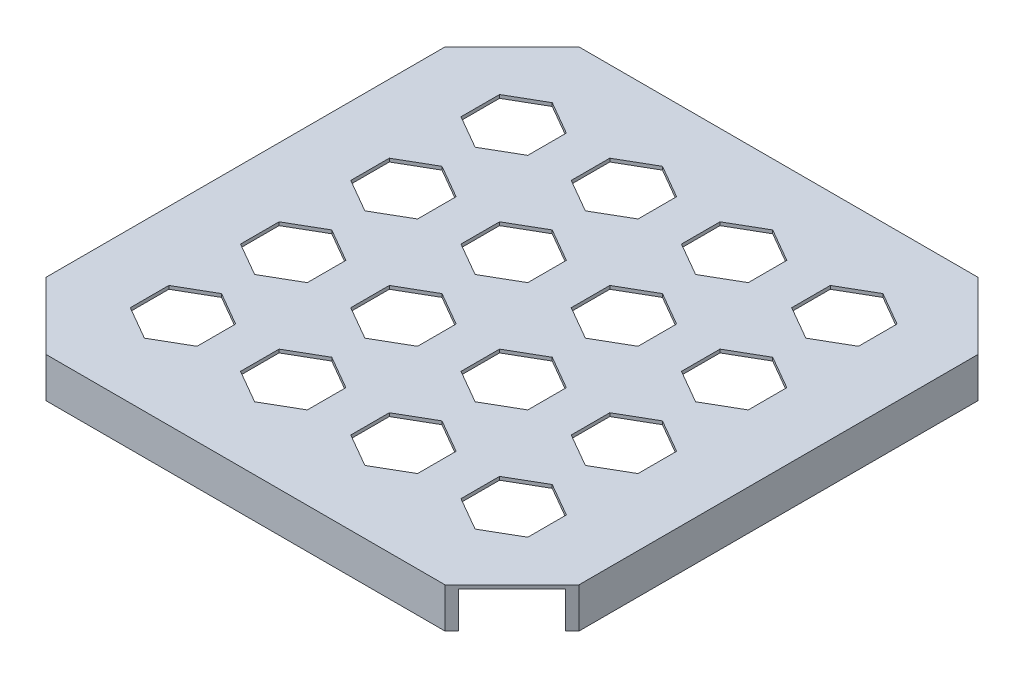
from build123d import *

# Parameters (mm, degrees)
BOSS_EXTRUDE1_DEPTH = 12
SKETCH5_W           = 155.5
SKETCH5_H           = 155.5
CUT_EXTRUDE3_DEPTH  = 11
CUT_EXTRUDE4_DEPTH  = 11


with BuildPart() as part:
    # Sketch1 → Boss-Extrude1 (new body)
    with BuildSketch(Plane(origin=(0, 0, 0), x_dir=(1, 0, 0), z_dir=(0, 1, 0))):
        Polygon((20, 159.5), (0, 139.5), (0, 20), (20, 0), (139.5, 0), (159.5, 20), (159.5, 139.5), (139.5, 159.5), align=None)
    extrude(amount=BOSS_EXTRUDE1_DEPTH)

    # Sketch5 → Cut-Extrude3 (cut)
    with BuildSketch(Plane.XZ):
        with Locations((79.75, -79.75)):
            Rectangle(SKETCH5_W, SKETCH5_H)
    extrude(amount=-CUT_EXTRUDE3_DEPTH, mode=Mode.SUBTRACT)

    # Sketch7 → Cut-Extrude4 (cut)
    with BuildSketch(Plane(origin=(0, 12, 0), x_dir=(1, 0, 0), z_dir=(0, 1, 0))):
        Polygon((139.5, 123.726497308), (139.5, 135.273502692), (129.5, 141.047005384), (119.5, 135.273502692), (119.5, 123.726497308), (129.5, 117.952994616), align=None)
        Polygon((106.5, 123.726497308), (106.5, 135.273502692), (96.5, 141.047005384), (86.5, 135.273502692), (86.5, 123.726497308), (96.5, 117.952994616), align=None)
        Polygon((73.5, 123.726497308), (73.5, 135.273502692), (63.5, 141.047005384), (53.5, 135.273502692), (53.5, 123.726497308), (63.5, 117.952994616), align=None)
        Polygon((40.5, 123.726497308), (40.5, 135.273502692), (30.5, 141.047005384), (20.5, 135.273502692), (20.5, 123.726497308), (30.5, 117.952994616), align=None)
        Polygon((106.5, 90.726497308), (106.5, 102.273502692), (96.5, 108.047005384), (86.5, 102.273502692), (86.5, 90.726497308), (96.5, 84.952994616), align=None)
        Polygon((73.5, 90.726497308), (73.5, 102.273502692), (63.5, 108.047005384), (53.5, 102.273502692), (53.5, 90.726497308), (63.5, 84.952994616), align=None)
        Polygon((40.5, 90.726497308), (40.5, 102.273502692), (30.5, 108.047005384), (20.5, 102.273502692), (20.5, 90.726497308), (30.5, 84.952994616), align=None)
        Polygon((106.5, 57.726497308), (106.5, 69.273502692), (96.5, 75.047005384), (86.5, 69.273502692), (86.5, 57.726497308), (96.5, 51.952994616), align=None)
        Polygon((73.5, 57.726497308), (73.5, 69.273502692), (63.5, 75.047005384), (53.5, 69.273502692), (53.5, 57.726497308), (63.5, 51.952994616), align=None)
        Polygon((40.5, 57.726497308), (40.5, 69.273502692), (30.5, 75.047005384), (20.5, 69.273502692), (20.5, 57.726497308), (30.5, 51.952994616), align=None)
        Polygon((106.5, 24.726497308), (106.5, 36.273502692), (96.5, 42.047005384), (86.5, 36.273502692), (86.5, 24.726497308), (96.5, 18.952994616), align=None)
        Polygon((73.5, 24.726497308), (73.5, 36.273502692), (63.5, 42.047005384), (53.5, 36.273502692), (53.5, 24.726497308), (63.5, 18.952994616), align=None)
        Polygon((40.5, 24.726497308), (40.5, 36.273502692), (30.5, 42.047005384), (20.5, 36.273502692), (20.5, 24.726497308), (30.5, 18.952994616), align=None)
        Polygon((139.5, 90.726497308), (139.5, 102.273502692), (129.5, 108.047005384), (119.5, 102.273502692), (119.5, 90.726497308), (129.5, 84.952994616), align=None)
        Polygon((139.5, 57.726497308), (139.5, 69.273502692), (129.5, 75.047005384), (119.5, 69.273502692), (119.5, 57.726497308), (129.5, 51.952994616), align=None)
        Polygon((139.5, 24.726497308), (139.5, 36.273502692), (129.5, 42.047005384), (119.5, 36.273502692), (119.5, 24.726497308), (129.5, 18.952994616), align=None)
    extrude(amount=-CUT_EXTRUDE4_DEPTH, mode=Mode.SUBTRACT)


solid = part.part
